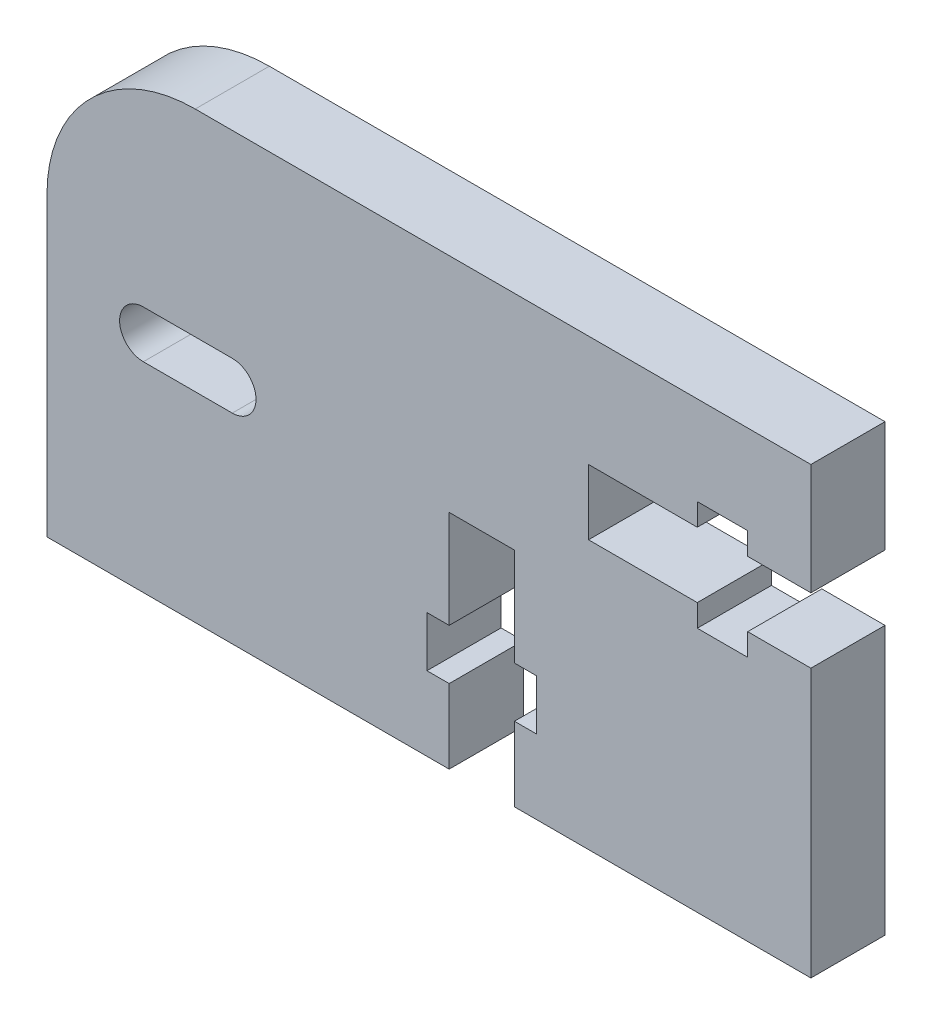
from build123d import *

# Parameters (mm, degrees)
SKETCH1_W           = 51.53
SKETCH1_H           = 30
BOSS_EXTRUDE1_DEPTH = 5
CUT_EXTRUDE1_DEPTH  = 5
FILLET1_R           = 10
CUT_EXTRUDE5_DEPTH  = 10


with BuildPart() as part:
    # Sketch1 → Boss-Extrude1 (new body)
    with BuildSketch(Plane.XY):
        with Locations((2.765, -5)):
            Rectangle(SKETCH1_W, SKETCH1_H)
    extrude(amount=BOSS_EXTRUDE1_DEPTH)

    # Sketch2 → Cut-Extrude1 (cut)
    with BuildSketch(Plane.XY.offset(5)):
        Polygon((13.53, -1.9), (20.865904873, -1.9), (20.865904873, -3.4), (24.265904873, -3.4), (24.265904873, -1.9), (28.53, -1.9), (28.53, 2.5), (24.265904873, 2.5), (24.265904873, 4), (20.865904873, 4), (20.865904873, 2.5), (13.53, 2.5), align=None)
        Polygon((4.13, -5), (4.13, -11.6), (2.63, -11.6), (2.63, -15), (4.13, -15), (4.13, -20), (8.53, -20), (8.53, -15), (10.03, -15), (10.03, -11.6), (8.53, -11.6), (8.53, -5), align=None)
    extrude(amount=-CUT_EXTRUDE1_DEPTH, mode=Mode.SUBTRACT)

    # Fillet1
    fillet1_edges = [part.edges().sort_by_distance(p)[0] for p in [
        (-23, 10, 2.5),
    ]]
    fillet(fillet1_edges, radius=FILLET1_R)

    # Sketch6 → Cut-Extrude5 (cut)
    with BuildSketch(Plane.XY.offset(5)):
        with BuildLine():
            Line((-16.500870191, -3.314520992), (-10.500870191, -3.314520992))
            ThreePointArc((-10.500870191, -3.314520992), (-8.900870191, -4.914520992), (-10.500870191, -6.514520992))
            Line((-10.500870191, -6.514520992), (-16.500870191, -6.514520992))
            ThreePointArc((-16.500870191, -6.514520992), (-18.100870191, -4.914520992), (-16.500870191, -3.314520992))
        make_face()
    extrude(amount=-CUT_EXTRUDE5_DEPTH, mode=Mode.SUBTRACT)


solid = part.part
